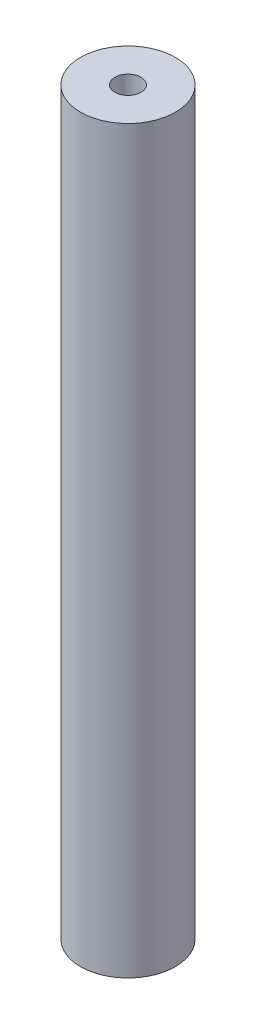
from build123d import *

# Parameters (mm, degrees)
TUBO_START  = -46.75
SK_TUBO_R   = 6
SK_TUBO_R_2 = 1.65
TUBO_DEPTH  = 93.5


with BuildPart() as part:
    # Sk_Tubo → Tubo (new body)
    with BuildSketch(Plane(origin=(0, 0, 0), x_dir=(1, 0, 0), z_dir=(0, 1, 0)).offset(TUBO_START)):
        with Locations(Location((0, -250, 0), (0, 0, 270))):
            Circle(SK_TUBO_R)
        with Locations(Location((0, -250, 0), (0, 0, 270))):
            Circle(SK_TUBO_R_2, mode=Mode.SUBTRACT)
    extrude(amount=TUBO_DEPTH)


solid = part.part
